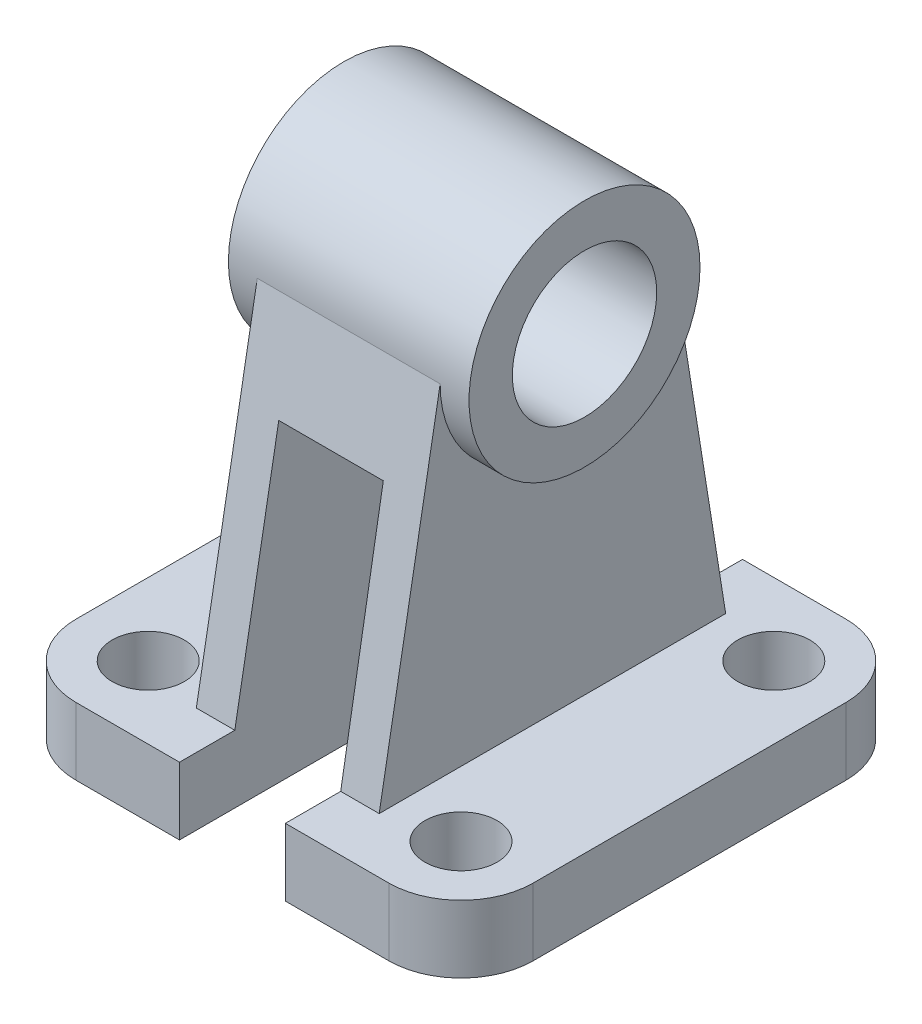
from build123d import *

# Parameters (mm, degrees)
SKETCH2_R             = 7.5
BOSS_EXTRUDE2_DEPTH   = 14
BOSS_EXTRUDE2_2_DEPTH = 14
BOSS_EXTRUDE3_DEPTH   = 8
BOSS_EXTRUDE4_DEPTH   = 30
BOSS_EXTRUDE5_START   = 6
SKETCH6_R             = 24
SKETCH6_R_2           = 15
BOSS_EXTRUDE5_DEPTH   = 6
SKETCH7_R             = 24
SKETCH7_R_2           = 15
BOSS_EXTRUDE6_DEPTH   = 6
CUT_EXTRUDE1_REACH    = 151.907
SKETCH8_R             = 15
CUT_EXTRUDE2_REACH    = 148.253


with BuildPart() as part:
    # Sketch2 → Boss-Extrude2 (new body)
    with BuildSketch(Plane(origin=(0, 0, 0), x_dir=(1, 0, 0), z_dir=(0, 1, 0))):
        with BuildLine():
            Line((-9.632034576, 0), (11.867965424, 0))
            Line((11.867965424, 0), (11.867965424, 95))
            Line((11.867965424, 95), (-9.632034576, 95))
            ThreePointArc((-9.632034576, 95), (-20.238636294, 90.606601718), (-24.632034576, 80))
            Line((-24.632034576, 80), (-24.632034576, 15))
            ThreePointArc((-24.632034576, 15), (-20.238636294, 4.393398282), (-9.632034576, 0))
        make_face()
        with Locations(Location((-9.632034576, 15, 0), (0, 0, 270))):
            Circle(SKETCH2_R, mode=Mode.SUBTRACT)
        with Locations(Location((-9.632034576, 80, 0), (0, 0, 270))):
            Circle(SKETCH2_R, mode=Mode.SUBTRACT)
    extrude(amount=-BOSS_EXTRUDE2_DEPTH)



with BuildPart() as body_2:
    # Sketch2 → Boss-Extrude2 2 (new body)
    with BuildSketch(Plane(origin=(0, 0, 0), x_dir=(1, 0, 0), z_dir=(0, 1, 0))):
        with BuildLine():
            Line((33.867965424, 0), (55.367965424, 0))
            ThreePointArc((55.367965424, 0), (65.974567142, 4.393398282), (70.367965424, 15))
            Line((70.367965424, 15), (70.367965424, 80))
            ThreePointArc((70.367965424, 80), (65.974567142, 90.606601718), (55.367965424, 95))
            Line((55.367965424, 95), (33.867965424, 95))
            Line((33.867965424, 95), (33.867965424, 0))
        make_face()
        with Locations(Location((55.367965424, 15, 0), (0, 0, 270))):
            Circle(SKETCH2_R, mode=Mode.SUBTRACT)
        with Locations(Location((55.367965424, 80, 0), (0, 0, 270))):
            Circle(SKETCH2_R, mode=Mode.SUBTRACT)
    extrude(amount=-BOSS_EXTRUDE2_2_DEPTH)

    # Sketch4 → Boss-Extrude3 (add)
    with BuildSketch(Plane.ZY.offset(-33.867965424)):
        with BuildLine():
            ThreePointArc((-24.166847457, 71), (-48.166847457, 47), (-72.166847457, 71))
            Line((-72.166847457, 71), (-83.5, 0))
            Line((-83.5, 0), (-11.5, 0))
            Line((-11.5, 0), (-24.166847457, 71))
        make_face()
        with BuildLine():
            ThreePointArc((-24.166847457, 71), (-48.166847457, 95), (-72.166847457, 71))
            Line((-72.166847457, 71), (-24.166847457, 71))
        make_face()
        with BuildLine():
            Line((-24.166847457, 71), (-72.166847457, 71))
            ThreePointArc((-72.166847457, 71), (-48.166847457, 47), (-24.166847457, 71))
        make_face()
    extrude(amount=-BOSS_EXTRUDE3_DEPTH)


with BuildPart() as part_1:
    add(part.part)

    add(body_2.part)  # Boss-Extrude4 merges body 2
    # Sketch5 → Boss-Extrude4 (add)
    with BuildSketch(Plane.ZY.offset(-33.867965424)):
        with BuildLine():
            Line((-72.166847457, 71), (-83.5, 0))
            Line((-83.5, 0), (-11.5, 0))
            Line((-11.5, 0), (-24.166847457, 71))
            ThreePointArc((-24.166847457, 71), (-48.166847457, 47), (-72.166847457, 71))
        make_face()
        with BuildLine():
            ThreePointArc((-24.166847457, 71), (-48.166847457, 95), (-72.166847457, 71))
            ThreePointArc((-72.166847457, 71), (-48.166847457, 47), (-24.166847457, 71))
        make_face()
    extrude(amount=BOSS_EXTRUDE4_DEPTH)

    # Sketch6 → Boss-Extrude5 (add)
    with BuildSketch(Plane.ZY.offset(-3.867965424).offset(BOSS_EXTRUDE5_START)):
        with Locations((-48.166847457, 71)):
            Circle(SKETCH6_R)
        with Locations((-48.166847457, 71)):
            Circle(SKETCH6_R_2, mode=Mode.SUBTRACT)
    extrude(amount=-BOSS_EXTRUDE5_DEPTH)

    # Sketch7 → Boss-Extrude6 (add)
    with BuildSketch(Plane(origin=(41.867965424, 0, 0), x_dir=(0, 0, -1), z_dir=(1, 0, 0))):
        with Locations((48.166847457, 71)):
            Circle(SKETCH7_R)
        with Locations(Location((48.166847457, 71, 0), (0, 0, 180))):
            Circle(SKETCH7_R_2, mode=Mode.SUBTRACT)
    extrude(amount=BOSS_EXTRUDE6_DEPTH)

    # Sketch8 → Cut-Extrude1 (cut, up to next)
    with BuildSketch(Plane(origin=(41.867965424, 0, 0), x_dir=(0, 0, -1), z_dir=(1, 0, 0)), mode=Mode.PRIVATE) as cut_extrude1_sk1:
        with Locations((48.166847457, 71)):
            Circle(SKETCH8_R)
    cut_extrude1_tool1 = extrude(cut_extrude1_sk1.sketch, amount=-CUT_EXTRUDE1_REACH, mode=Mode.PRIVATE) & part_1.part
    add(cut_extrude1_tool1.solids().sort_by_distance((41.867965, 71, -48.166847))[0], mode=Mode.SUBTRACT)

    # Cut-Extrude2: up to this plane
    cut_extrude2_end = Plane(origin=(3.867965424, 12.997266696, -81.425352027), z_dir=(0, -0.1576264048748577, 0.9874988184733324))
    # Sketch9 → Cut-Extrude2 (cut, up to the surface)
    with BuildSketch(Plane(origin=(0, -1.988384564, -11.145259663), x_dir=(1, 0, 0), z_dir=(0, 0.1756331001157612, 0.9844556943528373)), mode=Mode.PRIVATE) as cut_extrude2_sk1:
        Polygon((11.867965424, 2.019780651), (11.867965424, 54.019780651), (33.588609599, 54.019780651), (33.867965424, 2.019780651), align=None)
    cut_extrude2_tool1 = split(extrude(cut_extrude2_sk1.sketch, amount=-CUT_EXTRUDE2_REACH, mode=Mode.PRIVATE), bisect_by=cut_extrude2_end, keep=Keep.BOTH, mode=Mode.PRIVATE)
    add(cut_extrude2_tool1.solids().sort_by_distance((22.798275, 25.541333, -16.056735))[0], mode=Mode.SUBTRACT)


solid = part_1.part
